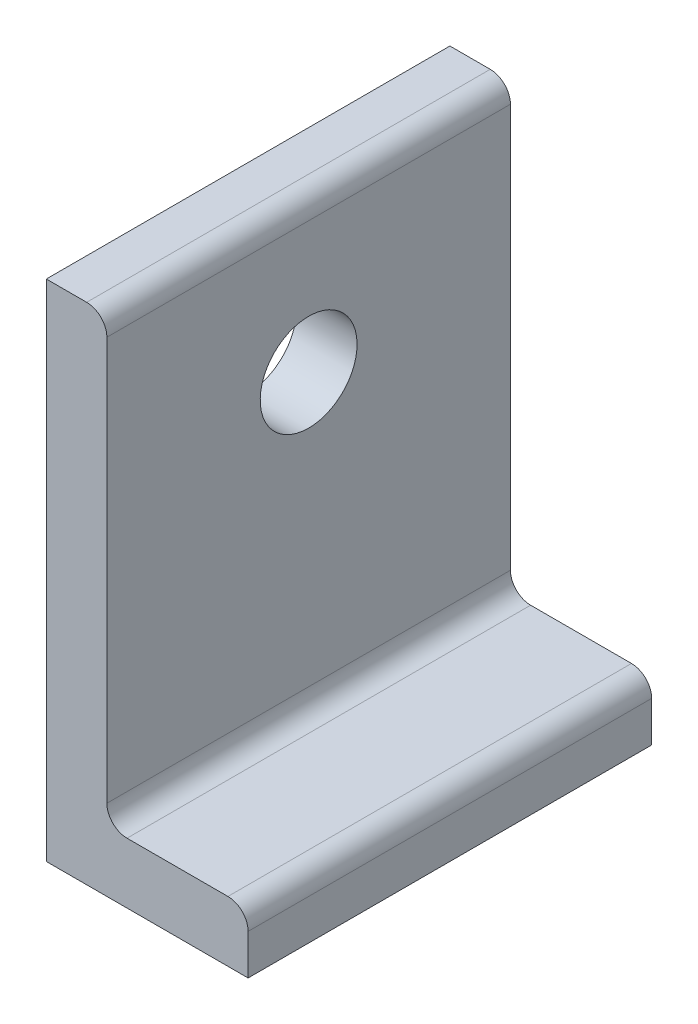
from build123d import *

# Parameters (mm, degrees)
EXTRUDE_1_DEPTH     = 20
SKETCH_2_R          = 2.4
CUT_EXTRUDE_1_DEPTH = 15
FILLET_1_R          = 1


with BuildPart() as part:
    # 草图1 → 凸台-拉伸1 (new body)
    with BuildSketch(Plane.XY):
        Polygon((0, 25), (0, 0), (10, 0), (10, 3), (3, 3), (3, 25), align=None)
    extrude(amount=EXTRUDE_1_DEPTH)

    # 草图2 → 切除-拉伸1 (cut)
    with BuildSketch(Plane.ZY):
        with Locations(Location((10, 17.5, 0), (0, 0, 270))):
            Circle(SKETCH_2_R)
    extrude(amount=-CUT_EXTRUDE_1_DEPTH, mode=Mode.SUBTRACT)

    # 圆角1
    fillet_1_edges = [part.edges().sort_by_distance(p)[0] for p in [
        (3, 25, 10),
        (3, 3, 10),
        (10, 3, 10),
    ]]
    fillet(fillet_1_edges, radius=FILLET_1_R)


solid = part.part
